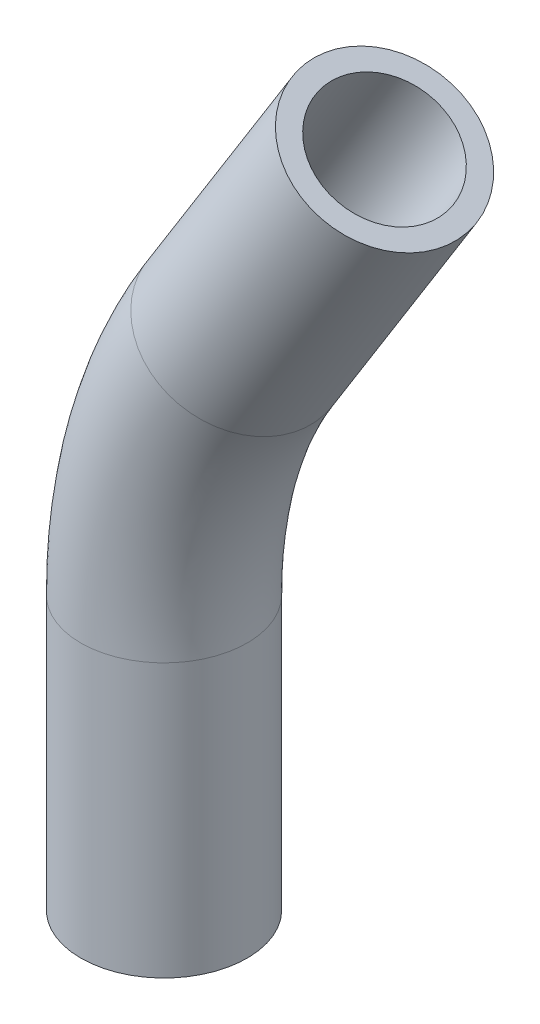
from build123d import *

# Parameters (mm, degrees)
SKETCH2_R   = 4
SKETCH2_R_2 = 3


with BuildPart() as part:
    # Sweep1: sweep along a path in Sketch1
    with BuildLine(Plane.XY) as sweep1_path:
        Line((0, 0), (0, 13.118110742))
        ThreePointArc((0, 13.118110742), (0.929719297, 19.733407281), (3.646845692, 25.836173083))
        Line((3.646845692, 25.836173083), (10.598385285, 36.960961923))
    # Sketch2 → Sweep1 (sweep)
    with BuildSketch(Plane(origin=(0, 0, 0), x_dir=(1, 0, 0), z_dir=(0, 1, 0))):
        Circle(SKETCH2_R)
        Circle(SKETCH2_R_2, mode=Mode.SUBTRACT)
    sweep(path=sweep1_path.line)


solid = part.part
